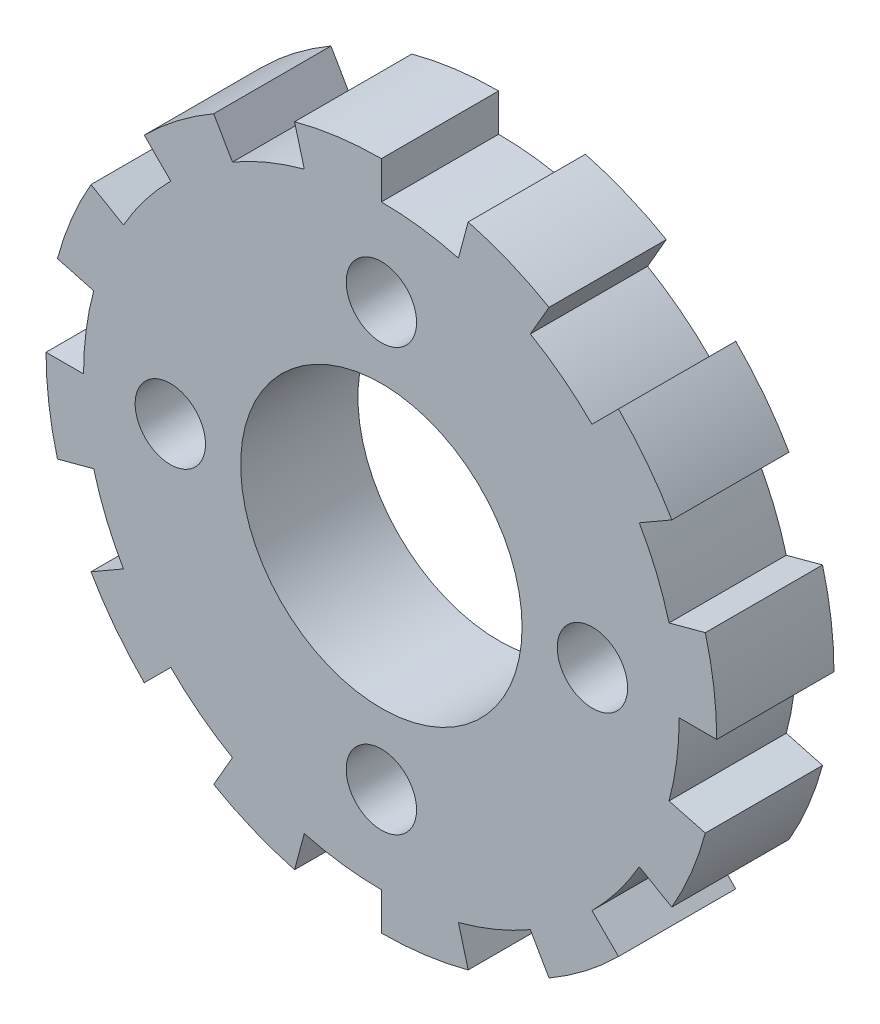
from build123d import *

# Parameters (mm, degrees)
EXTRUDE_1_DEPTH          = 5
EXTRUDE_1_DEPTH_BACK     = 5
SKETCH_1_R               = 12
CUT_EXTRUDE_1_DEPTH      = 10
CUT_EXTRUDE_1_DEPTH_BACK = 10
SKETCH_2_R               = 3


with BuildPart() as part:
    # 草图1 → 凸台-拉伸1 (new, two sides: drawn at the far end of the back side and taken through both)
    with BuildSketch(Plane.XY.offset(-EXTRUDE_1_DEPTH_BACK)):
        with BuildLine():
            Line((21.997045256, -12.7), (24.768326548, -14.3))
            ThreePointArc((24.768326548, -14.3), (26.42295463, -10.944746166), (27.625478632, -7.40222469))
            Line((27.625478632, -7.40222469), (24.534515988, -6.574003746))
            ThreePointArc((24.534515988, -6.574003746), (25.182699479, -3.315365282), (25.4, 0))
            Line((25.4, 0), (28.6, 0))
            ThreePointArc((28.6, 0), (28.355323035, 3.733049097), (27.625478632, 7.40222469))
            Line((27.625478632, 7.40222469), (24.534515988, 6.574003746))
            ThreePointArc((24.534515988, 6.574003746), (23.466540126, 9.720159182), (21.997045256, 12.7))
            Line((21.997045256, 12.7), (24.768326548, 14.3))
            ThreePointArc((24.768326548, 14.3), (22.689905532, 17.41057687), (20.223253942, 20.223253942))
            Line((20.223253942, 20.223253942), (17.960512242, 17.960512242))
            ThreePointArc((17.960512242, 17.960512242), (15.462540297, 20.151174843), (12.7, 21.997045256))
            Line((12.7, 21.997045256), (14.3, 24.768326548))
            ThreePointArc((14.3, 24.768326548), (10.944746166, 26.42295463), (7.40222469, 27.625478632))
            Line((7.40222469, 27.625478632), (6.574003746, 24.534515988))
            ThreePointArc((6.574003746, 24.534515988), (3.315365282, 25.182699479), (0, 25.4))
            Line((0, 25.4), (0, 28.6))
            ThreePointArc((0, 28.6), (-3.733049097, 28.355323035), (-7.40222469, 27.625478632))
            Line((-7.40222469, 27.625478632), (-6.574003746, 24.534515988))
            ThreePointArc((-6.574003746, 24.534515988), (-9.720159182, 23.466540126), (-12.7, 21.997045256))
            Line((-12.7, 21.997045256), (-14.3, 24.768326548))
            ThreePointArc((-14.3, 24.768326548), (-17.41057687, 22.689905532), (-20.223253942, 20.223253942))
            Line((-20.223253942, 20.223253942), (-17.960512242, 17.960512242))
            ThreePointArc((-17.960512242, 17.960512242), (-20.151174843, 15.462540297), (-21.997045256, 12.7))
            Line((-21.997045256, 12.7), (-24.768326548, 14.3))
            ThreePointArc((-24.768326548, 14.3), (-26.42295463, 10.944746166), (-27.625478632, 7.40222469))
            Line((-27.625478632, 7.40222469), (-24.534515988, 6.574003746))
            ThreePointArc((-24.534515988, 6.574003746), (-25.182699479, 3.315365282), (-25.4, 0))
            Line((-25.4, 0), (-28.6, 0))
            ThreePointArc((-28.6, 0), (-28.355323035, -3.733049097), (-27.625478632, -7.40222469))
            Line((-27.625478632, -7.40222469), (-24.534515988, -6.574003746))
            ThreePointArc((-24.534515988, -6.574003746), (-23.466540126, -9.720159182), (-21.997045256, -12.7))
            Line((-21.997045256, -12.7), (-24.768326548, -14.3))
            ThreePointArc((-24.768326548, -14.3), (-22.689905532, -17.41057687), (-20.223253942, -20.223253942))
            Line((-20.223253942, -20.223253942), (-17.960512242, -17.960512242))
            ThreePointArc((-17.960512242, -17.960512242), (-15.462540297, -20.151174843), (-12.7, -21.997045256))
            Line((-12.7, -21.997045256), (-14.3, -24.768326548))
            ThreePointArc((-14.3, -24.768326548), (-10.944746166, -26.42295463), (-7.40222469, -27.625478632))
            Line((-7.40222469, -27.625478632), (-6.574003746, -24.534515988))
            ThreePointArc((-6.574003746, -24.534515988), (-3.315365282, -25.182699479), (0, -25.4))
            Line((0, -25.4), (0, -28.6))
            ThreePointArc((0, -28.6), (3.733049097, -28.355323035), (7.40222469, -27.625478632))
            Line((7.40222469, -27.625478632), (6.574003746, -24.534515988))
            ThreePointArc((6.574003746, -24.534515988), (9.720159182, -23.466540126), (12.7, -21.997045256))
            Line((12.7, -21.997045256), (14.3, -24.768326548))
            ThreePointArc((14.3, -24.768326548), (17.41057687, -22.689905532), (20.223253942, -20.223253942))
            Line((20.223253942, -20.223253942), (17.960512242, -17.960512242))
            ThreePointArc((17.960512242, -17.960512242), (20.151174843, -15.462540297), (21.997045256, -12.7))
        make_face()
        Circle(SKETCH_1_R, mode=Mode.SUBTRACT)
    extrude(amount=EXTRUDE_1_DEPTH + EXTRUDE_1_DEPTH_BACK)

    # 草图2 → 切除-拉伸1 (cut, two sides: drawn at the far end of the back side and taken through both)
    with BuildSketch(Plane.XY.offset(-CUT_EXTRUDE_1_DEPTH_BACK)):
        with Locations((18, 0)):
            Circle(SKETCH_2_R)
        with Locations((0, -18)):
            Circle(SKETCH_2_R)
        with Locations((-18, 0)):
            Circle(SKETCH_2_R)
        with Locations((0, 18)):
            Circle(SKETCH_2_R)
    extrude(amount=CUT_EXTRUDE_1_DEPTH + CUT_EXTRUDE_1_DEPTH_BACK, mode=Mode.SUBTRACT)


solid = part.part
